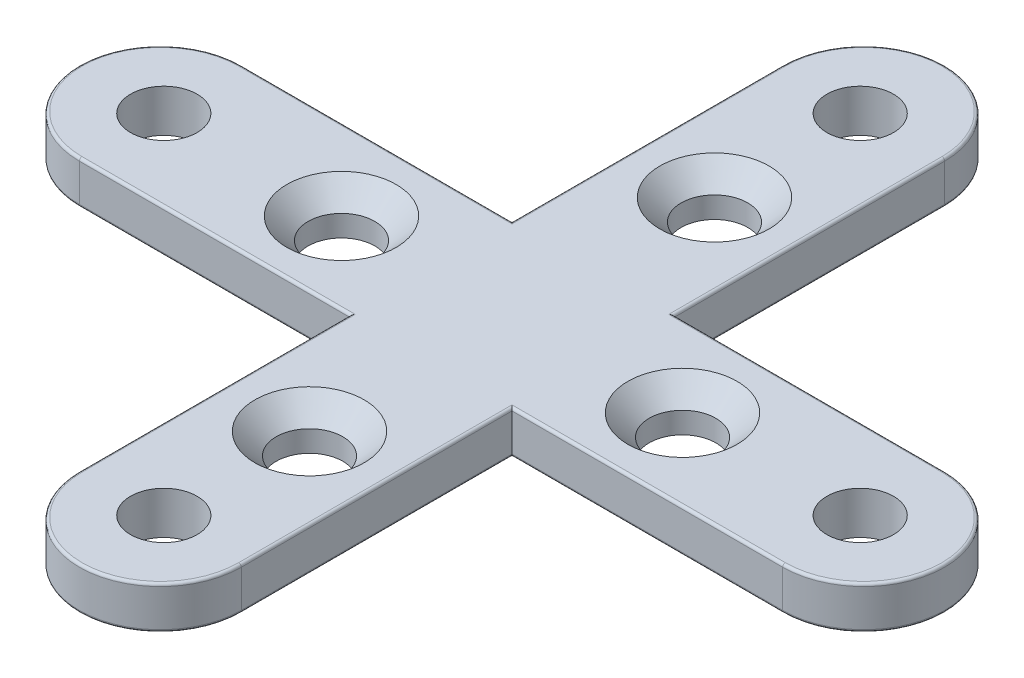
from build123d import *

# Parameters (mm, degrees)
SKETCH1_R           = 1.5625
BOSS_EXTRUDE1_DEPTH = 2
CIRPATTERN1_COUNT   = 2
CIRPATTERN1_ANGLE   = 90
SKETCH2_R           = 1.5625
CUT_EXTRUDE1_DEPTH  = 2
CHAMFER1_SIZE       = 1
FILLET1_R           = 0.125


with BuildPart() as part:
    # Sketch1 → Boss-Extrude1 (new body)
    with BuildSketch(Plane(origin=(0, 0, 0), x_dir=(1, 0, 0), z_dir=(0, 1, 0))):
        with BuildLine():
            Line((-3.8, -16.5), (-3.8, 16.5))
            ThreePointArc((-3.8, 16.5), (0, 20.3), (3.8, 16.5))
            Line((3.8, 16.5), (3.8, -16.5))
            ThreePointArc((3.8, -16.5), (0, -20.3), (-3.8, -16.5))
        make_face()
        with Locations(Location((0, 16.3375, 0), (0, 0, 270))):
            Circle(SKETCH1_R, mode=Mode.SUBTRACT)
        with Locations(Location((0, -16.3375, 0), (0, 0, 90))):
            Circle(SKETCH1_R, mode=Mode.SUBTRACT)
    boss_extrude1 = extrude(amount=BOSS_EXTRUDE1_DEPTH)

    # CirPattern1: Boss-Extrude1 ×2 about axis
    cirpattern1_axis = Axis((0, 0, 0), (0, 1, 0))
    for i in range(1, CIRPATTERN1_COUNT):
        add(boss_extrude1.rotate(cirpattern1_axis, i * CIRPATTERN1_ANGLE / (CIRPATTERN1_COUNT - 1)))

    # Sketch2 → Cut-Extrude1 (cut)
    with BuildSketch(Plane(origin=(0, 0, 0), x_dir=(1, 0, 0), z_dir=(0, 1, 0))):
        with Locations(Location((0, 9.5, 0), (0, 0, 270))):
            Circle(SKETCH2_R)
        with Locations(Location((8, 0, 0), (0, 0, 270))):
            Circle(SKETCH2_R)
        with Locations(Location((0, -9.5, 0), (0, 0, 90))):
            Circle(SKETCH2_R)
        with Locations(Location((-8, 0, 0), (0, 0, 90))):
            Circle(SKETCH2_R)
    extrude(amount=CUT_EXTRUDE1_DEPTH, mode=Mode.SUBTRACT)

    # Chamfer1
    chamfer1_edges = [part.edges().sort_by_distance(p)[0] for p in [
        (0, 2, -11.0625),
        (8, 2, -1.5625),
        (0, 2, 11.0625),
        (-8, 2, 1.5625),
    ]]
    chamfer(chamfer1_edges, length=CHAMFER1_SIZE)

    # Fillet1
    fillet1_edges = [part.edges().sort_by_distance(p)[0] for p in [
        (0, 2, -20.3),
        (-3.8, 2, -10.15),
        (-3.8, 0, 10.15),
        (-3.8, 2, 10.15),
        (3.8, 0, -10.15),
        (3.8, 2, -10.15),
        (10.15, 2, 3.8),
        (20.3, 2, 0),
        (10.15, 2, -3.8),
        (-10.15, 2, -3.8),
        (-20.3, 2, 0),
        (-10.15, 2, 3.8),
        (10.15, 0, -3.8),
        (-10.15, 0, -3.8),
        (10.15, 0, 3.8),
        (-10.15, 0, 3.8),
        (20.3, 0, 0),
        (-20.3, 0, 0),
        (0, 2, 20.3),
        (-3.8, 0, -10.15),
        (0, 0, -20.3),
        (3.8, 0, 10.15),
        (0, 0, 20.3),
        (3.8, 2, 10.15),
    ]]
    fillet(fillet1_edges, radius=FILLET1_R)


solid = part.part
